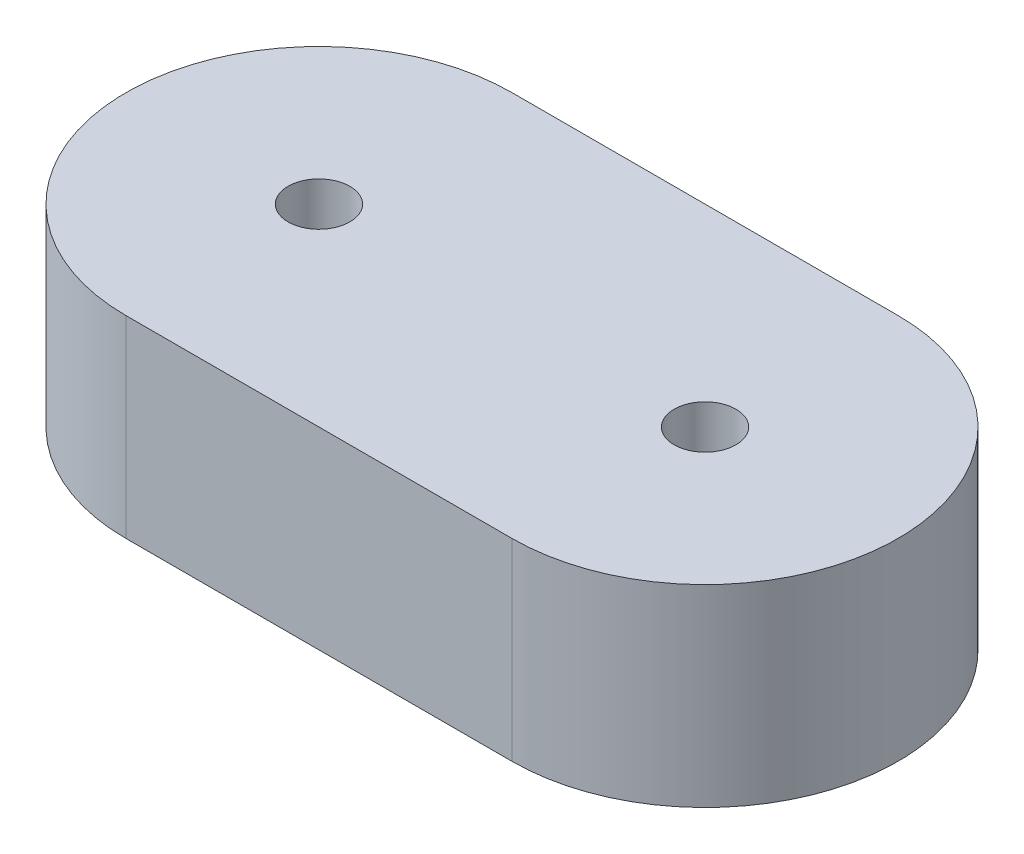
from build123d import *

# Parameters (mm, degrees)
SKETCH1_R           = 1.6
BOSS_EXTRUDE1_DEPTH = 10


with BuildPart() as part:
    # Sketch1 → Boss-Extrude1 (new body)
    with BuildSketch(Plane(origin=(0, 0, 0), x_dir=(1, 0, 0), z_dir=(0, 1, 0))):
        with BuildLine():
            Line((-10, 10), (10, 10))
            ThreePointArc((10, 10), (20, 0), (10, -10))
            Line((10, -10), (-10, -10))
            ThreePointArc((-10, -10), (-20, 0), (-10, 10))
        make_face()
        with Locations(Location((-10, 0, 0), (0, 0, 270))):
            Circle(SKETCH1_R, mode=Mode.SUBTRACT)
        with Locations(Location((10, 0, 0), (0, 0, 270))):
            Circle(SKETCH1_R, mode=Mode.SUBTRACT)
    extrude(amount=BOSS_EXTRUDE1_DEPTH)


solid = part.part
